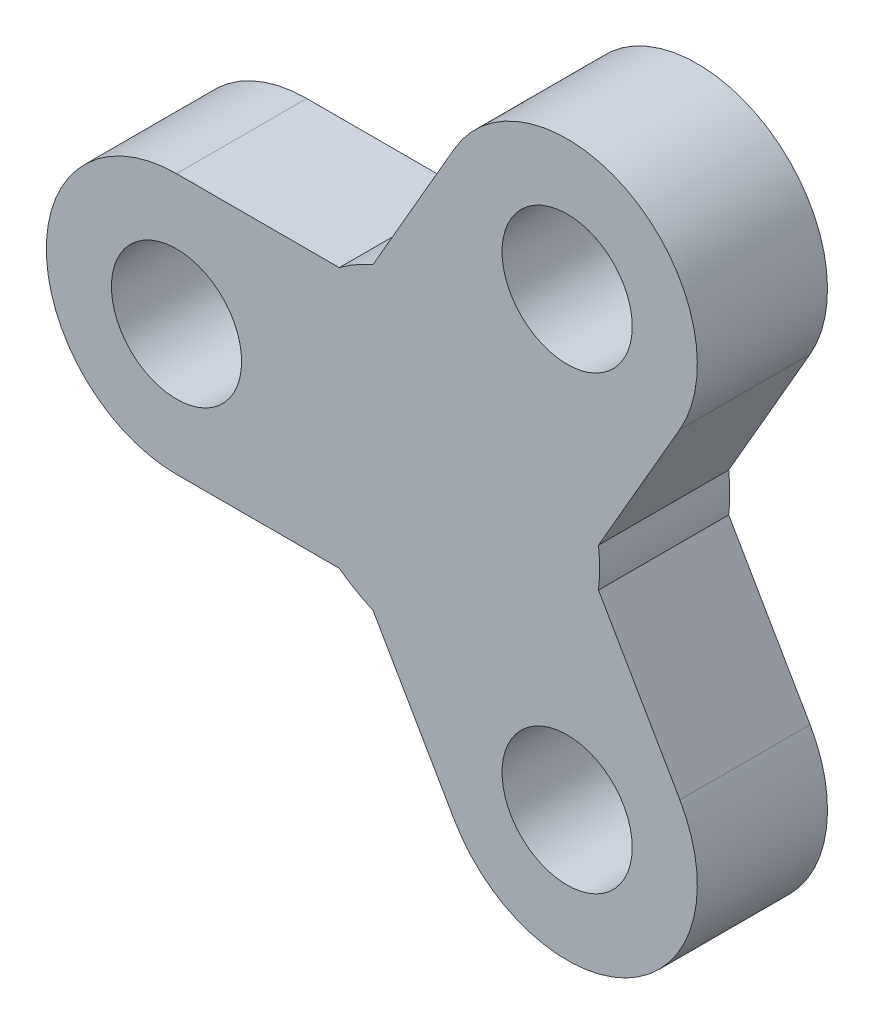
from build123d import *

# Parameters (mm, degrees)
CROQUIS1_R              = 5
SALIENTE_EXTRUIR1_DEPTH = 10


with BuildPart() as part:
    # Croquis1 → Saliente-Extruir1 (new body)
    with BuildSketch(Plane.XY):
        with BuildLine():
            Line((-20, 10), (-7.5, 10))
            ThreePointArc((-7.5, 10), (-6.25, 10.825317547), (-4.910254038, 11.495190528))
            Line((-4.910254038, 11.495190528), (1.339745962, 22.320508076))
            ThreePointArc((1.339745962, 22.320508076), (15, 25.980762114), (18.660254038, 12.320508076))
            Line((18.660254038, 12.320508076), (12.410254038, 1.495190528))
            ThreePointArc((12.410254038, 1.495190528), (12.499999989, 0), (12.410254038, -1.495190528))
            Line((12.410254038, -1.495190528), (18.660254038, -12.320508076))
            ThreePointArc((18.660254038, -12.320508076), (15, -25.980762114), (1.339745962, -22.320508076))
            Line((1.339745962, -22.320508076), (-4.910254038, -11.495190528))
            ThreePointArc((-4.910254038, -11.495190528), (-6.25, -10.825317547), (-7.5, -10))
            Line((-7.5, -10), (-20, -10))
            ThreePointArc((-20, -10), (-30, 0), (-20, 10))
        make_face()
        with Locations((-20, 0)):
            Circle(CROQUIS1_R, mode=Mode.SUBTRACT)
        with Locations((10, 17.320508076)):
            Circle(CROQUIS1_R, mode=Mode.SUBTRACT)
        with Locations((10, -17.320508076)):
            Circle(CROQUIS1_R, mode=Mode.SUBTRACT)
    extrude(amount=SALIENTE_EXTRUIR1_DEPTH)


solid = part.part
